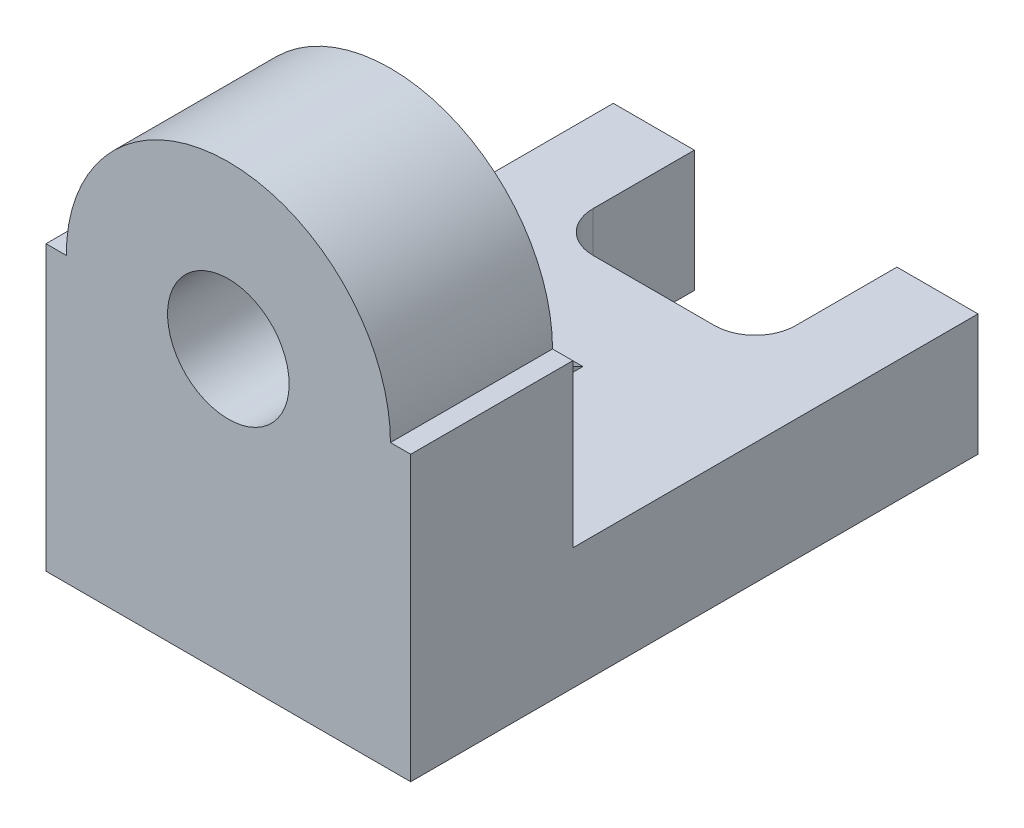
from build123d import *

# Parameters (mm, degrees)
BOSS_EXTRUDE1_DEPTH      = 70
BOSS_EXTRUDE1_DEPTH_BACK = 70
SKETCH1_R                = 15
SKETCH2_W                = 100
SKETCH2_H                = 80
CUT_EXTRUDE1_DEPTH       = 159.429795178
SKETCH3_W                = 50
SKETCH3_H                = 35
CUT_EXTRUDE2_DEPTH       = 116.433963806
FILLET1_R                = 10
RIB1_REACH               = 139.931
SKETCH4_WALL_W           = 322.583644032
SKETCH4_WALL_H           = 15


with BuildPart() as part:
    # Sketch1 → Boss-Extrude1 (new, two sides: drawn at the far end of the back side and taken through both)
    with BuildSketch(Plane.XY.offset(-BOSS_EXTRUDE1_DEPTH_BACK)):
        with BuildLine():
            Line((-40, 70), (-45, 70))
            Line((-45, 70), (-45, 0))
            Line((-45, 0), (45, 0))
            Line((45, 0), (45, 70))
            Line((45, 70), (40, 70))
            ThreePointArc((40, 70), (0, 110), (-40, 70))
        make_face()
        with Locations((0, 70)):
            Circle(SKETCH1_R, mode=Mode.SUBTRACT)
    extrude(amount=BOSS_EXTRUDE1_DEPTH + BOSS_EXTRUDE1_DEPTH_BACK)

    # Sketch2 → Cut-Extrude1 (cut, through all)
    with BuildSketch(Plane.ZY.offset(45)):
        with Locations((-20, 70)):
            Rectangle(SKETCH2_W, SKETCH2_H)
    extrude(amount=-CUT_EXTRUDE1_DEPTH, mode=Mode.SUBTRACT)

    # Sketch3 → Cut-Extrude2 (cut, through all)
    with BuildSketch(Plane(origin=(0, 30, 0), x_dir=(1, 0, 0), z_dir=(0, 1, 0))):
        with Locations((0, 52.5)):
            Rectangle(SKETCH3_W, SKETCH3_H)
    extrude(amount=-CUT_EXTRUDE2_DEPTH, mode=Mode.SUBTRACT)

    # Fillet1
    fillet1_edges = [part.edges().sort_by_distance(p)[0] for p in [
        (-25, 15, -35),
        (25, 15, -35),
    ]]
    fillet(fillet1_edges, radius=FILLET1_R)

    # Sketch4 wall → Rib1 (add, up to next)
    with BuildSketch(Plane(origin=(0, 40, 10), x_dir=(0, -0.4472135955, -0.894427191), z_dir=(0, 0.894427191, -0.4472135955)), mode=Mode.PRIVATE) as rib1_sk1:
        Rectangle(SKETCH4_WALL_W, SKETCH4_WALL_H)
    rib1_tool1 = extrude(rib1_sk1.sketch, amount=-RIB1_REACH, mode=Mode.PRIVATE) - part.part
    add(rib1_tool1.solids().sort_by_distance((0, 40, 10))[0])


solid = part.part
